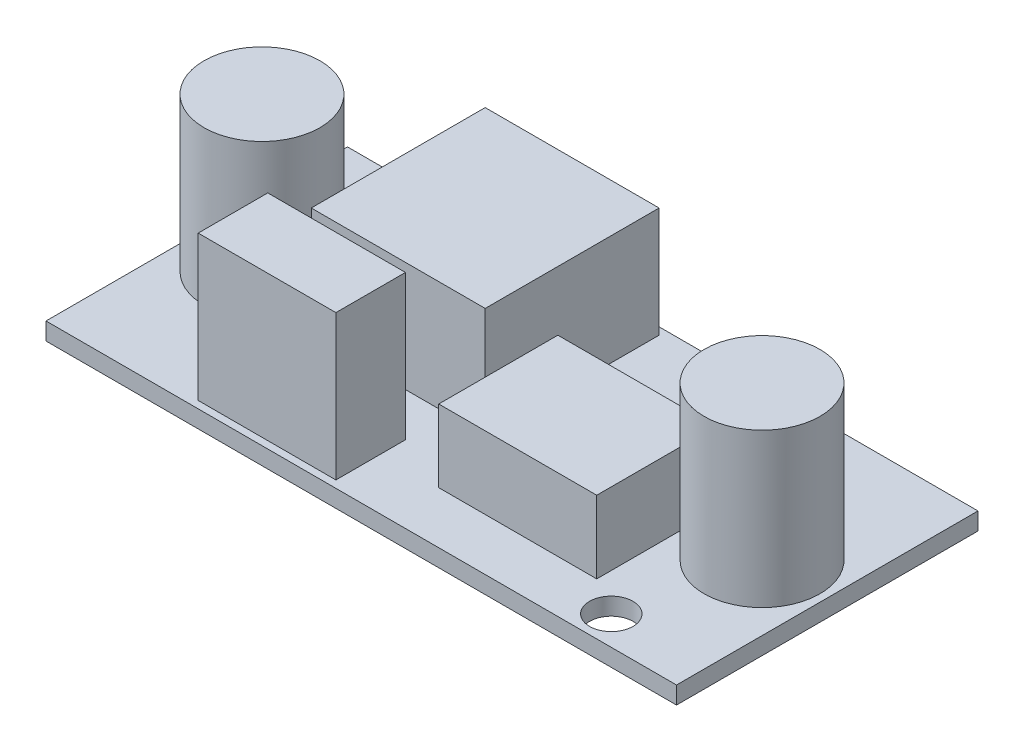
from build123d import *

# Parameters (mm, degrees)
SKETCH_1_W          = 43.5
SKETCH_1_H          = 20.8
EXTRUDE_1_DEPTH     = 1.2
SKETCH_2_W          = 12
SKETCH_2_H          = 12
EXTRUDE_2_DEPTH     = 7.6
SKETCH_3_R          = 4
EXTRUDE_3_DEPTH     = 10.6
SKETCH_4_W          = 9.5
SKETCH_4_H          = 4.8
EXTRUDE_4_DEPTH     = 10
SKETCH_5_W          = 10.901177872
SKETCH_5_H          = 8.219839766
EXTRUDE_5_DEPTH     = 5
SKETCH_6_R          = 1.5
CUT_EXTRUDE_1_DEPTH = 5


with BuildPart() as part:
    # 草图1 → 凸台-拉伸1 (new body)
    with BuildSketch(Plane(origin=(0, 0, 0), x_dir=(1, 0, 0), z_dir=(0, 1, 0))):
        Rectangle(SKETCH_1_W, SKETCH_1_H)
    extrude(amount=EXTRUDE_1_DEPTH)

    # 草图2 → 凸台-拉伸2 (add)
    with BuildSketch(Plane(origin=(0, 1.2, 0), x_dir=(1, 0, 0), z_dir=(0, 1, 0))):
        with Locations((-5.75, 3.9)):
            Rectangle(SKETCH_2_W, SKETCH_2_H)
    extrude(amount=EXTRUDE_2_DEPTH)

    # 草图3 → 凸台-拉伸3 (add)
    with BuildSketch(Plane(origin=(0, 1.2, 0), x_dir=(1, 0, 0), z_dir=(0, 1, 0))):
        with Locations(Location((-17.25, 0, 0), (0, 0, 90))):
            Circle(SKETCH_3_R)
        with Locations(Location((17.25, 0, 0), (0, 0, 90))):
            Circle(SKETCH_3_R)
    extrude(amount=EXTRUDE_3_DEPTH)

    # 草图4 → 凸台-拉伸4 (add)
    with BuildSketch(Plane(origin=(0, 1.2, 0), x_dir=(1, 0, 0), z_dir=(0, 1, 0))):
        with Locations((-7, -7.5)):
            Rectangle(SKETCH_4_W, SKETCH_4_H)
    extrude(amount=EXTRUDE_4_DEPTH)

    # 草图5 → 凸台-拉伸5 (add)
    with BuildSketch(Plane(origin=(0, 1.2, 0), x_dir=(1, 0, 0), z_dir=(0, 1, 0))):
        with Locations((7.208843432, -2.703316287)):
            Rectangle(SKETCH_5_W, SKETCH_5_H)
    extrude(amount=EXTRUDE_5_DEPTH)

    # 草图6 → 切除-拉伸1 (cut)
    with BuildSketch(Plane(origin=(0, 1.2, 0), x_dir=(1, 0, 0), z_dir=(0, 1, 0))):
        with Locations(Location((15.25, -8.4, 0), (0, 0, 270))):
            Circle(SKETCH_6_R)
        with Locations(Location((-15.25, 8.4, 0), (0, 0, 270))):
            Circle(SKETCH_6_R)
    extrude(amount=-CUT_EXTRUDE_1_DEPTH, mode=Mode.SUBTRACT)


solid = part.part
